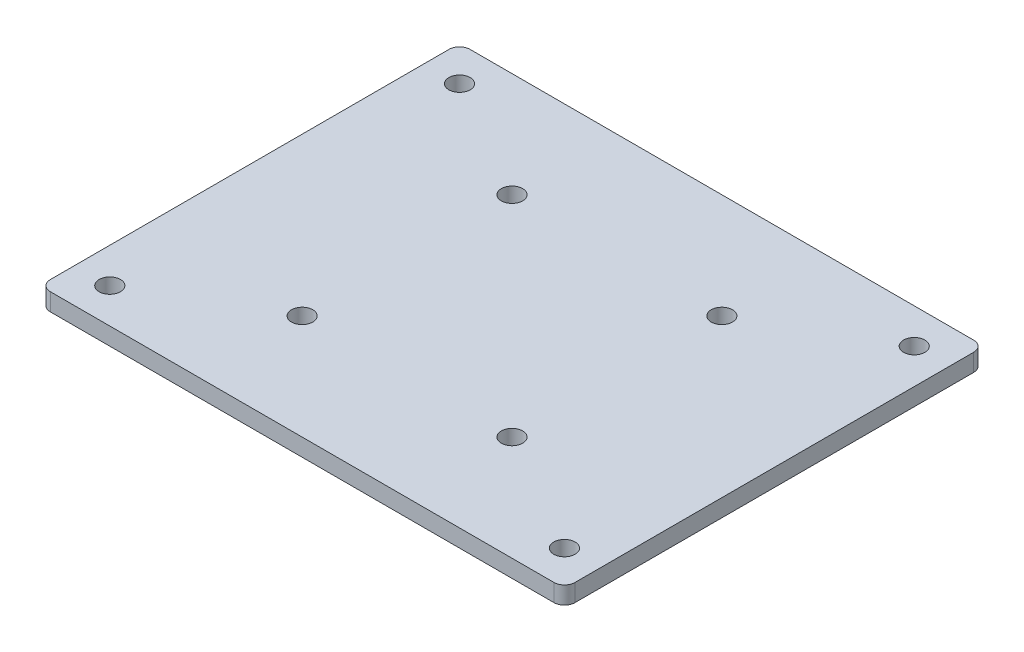
from build123d import *

# Parameters (mm, degrees)
SKETCH1_W           = 150
SKETCH1_H           = 120
BOSS_EXTRUDE1_DEPTH = 5
SKETCH2_R           = 3.05
CUT_EXTRUDE1_DEPTH  = 10
FILLET1_R           = 3


with BuildPart() as part:
    # Sketch1 → Boss-Extrude1 (new body)
    with BuildSketch(Plane(origin=(0, 0, 0), x_dir=(1, 0, 0), z_dir=(0, 1, 0))):
        Rectangle(SKETCH1_W, SKETCH1_H)
    extrude(amount=BOSS_EXTRUDE1_DEPTH)

    # Sketch2 → Cut-Extrude1 (cut)
    with BuildSketch(Plane(origin=(0, 5, 0), x_dir=(1, 0, 0), z_dir=(0, 1, 0))):
        with Locations(Location((-30, 30, 0), (0, 0, 270))):
            Circle(SKETCH2_R)
        with Locations(Location((30, 30, 0), (0, 0, 270))):
            Circle(SKETCH2_R)
        with Locations(Location((30, -30, 0), (0, 0, 270))):
            Circle(SKETCH2_R)
        with Locations(Location((-30, -30, 0), (0, 0, 270))):
            Circle(SKETCH2_R)
        with Locations(Location((-65, 50, 0), (0, 0, 270))):
            Circle(SKETCH2_R)
        with Locations(Location((65, 50, 0), (0, 0, 270))):
            Circle(SKETCH2_R)
        with Locations(Location((-65, -50, 0), (0, 0, 270))):
            Circle(SKETCH2_R)
        with Locations(Location((65, -50, 0), (0, 0, 270))):
            Circle(SKETCH2_R)
    extrude(amount=-CUT_EXTRUDE1_DEPTH, mode=Mode.SUBTRACT)

    # Fillet1
    fillet1_edges = [part.edges().sort_by_distance(p)[0] for p in [
        (75, 2.5, 60),
        (-75, 2.5, 60),
        (-75, 2.5, -60),
        (75, 2.5, -60),
    ]]
    fillet(fillet1_edges, radius=FILLET1_R)


solid = part.part
